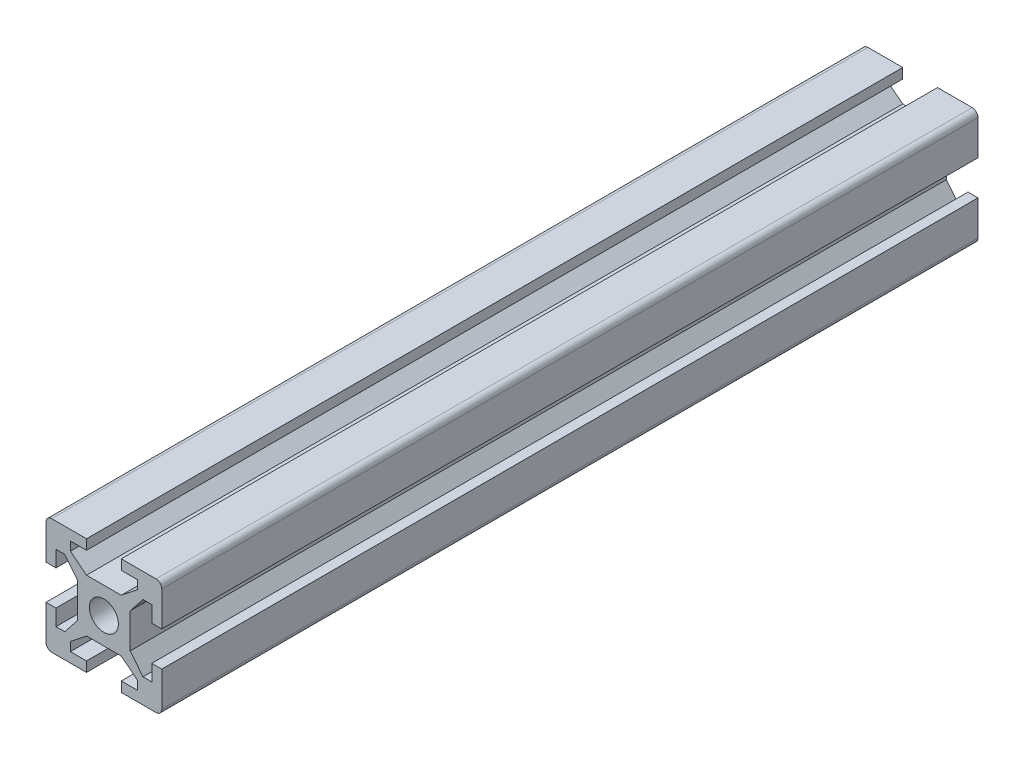
from build123d import *

# Parameters (mm, degrees)
BOSS_EXTRUDE1_DEPTH     = 70.5
CUT_EXTRUDE1_DEPTH      = 142.707445111
CUT_EXTRUDE1_DEPTH_BACK = 142.707445111
SKETCH2_R               = 2.5
FILLET1_R               = 1


with BuildPart() as part:
    # Sketch1 → Boss-Extrude1 (new, symmetric)
    with BuildSketch(Plane.XY):
        Polygon((-10, 10), (-3, 10), (-3, 8.272610059), (-5.783778863, 8.272610059), (-5.783778863, 6.747994248), (-3, 4.550753814), (3, 4.550753814), (5.783778863, 6.747994248), (5.783778863, 8.272610059), (3, 8.272610059), (3, 10), (10, 10), (10, 3), (8.272610059, 3), (8.272610059, 5.783778863), (6.747994248, 5.783778863), (4.55, 3.000595152), (4.55, -2.999404848), (6.747994248, -5.783778863), (8.272610059, -5.783778863), (8.272610059, -3), (10, -3), (10, -10), (3, -10), (3, -8.272610059), (5.783778863, -8.272610059), (5.783778863, -6.747994248), (2.999404848, -4.55), (-3.000595152, -4.55), (-5.783778863, -6.747994248), (-5.783778863, -8.272610059), (-3, -8.272610059), (-3, -10), (-10, -10), (-10, -3), (-8.272610059, -3), (-8.272610059, -5.783778863), (-6.747994248, -5.783778863), (-4.55, -3.000595152), (-4.55, 2.999404848), (-6.747994248, 5.783778863), (-8.272610059, 5.783778863), (-8.272610059, 3), (-10, 3), align=None)
    extrude(amount=BOSS_EXTRUDE1_DEPTH, both=True)

    # Sketch2 → Cut-Extrude1 (cut, two sides: drawn at the far end of the back side and taken through both)
    with BuildSketch(Plane.XY.offset(70.5).offset(-CUT_EXTRUDE1_DEPTH_BACK)):
        Circle(SKETCH2_R)
    extrude(amount=CUT_EXTRUDE1_DEPTH + CUT_EXTRUDE1_DEPTH_BACK, mode=Mode.SUBTRACT)

    # Fillet1
    fillet1_edges = [part.edges().sort_by_distance(p)[0] for p in [
        (-10, 10, 0),
        (10, 10, 0),
        (10, -10, 0),
        (-10, -10, 0),
    ]]
    fillet(fillet1_edges, radius=FILLET1_R)


solid = part.part
